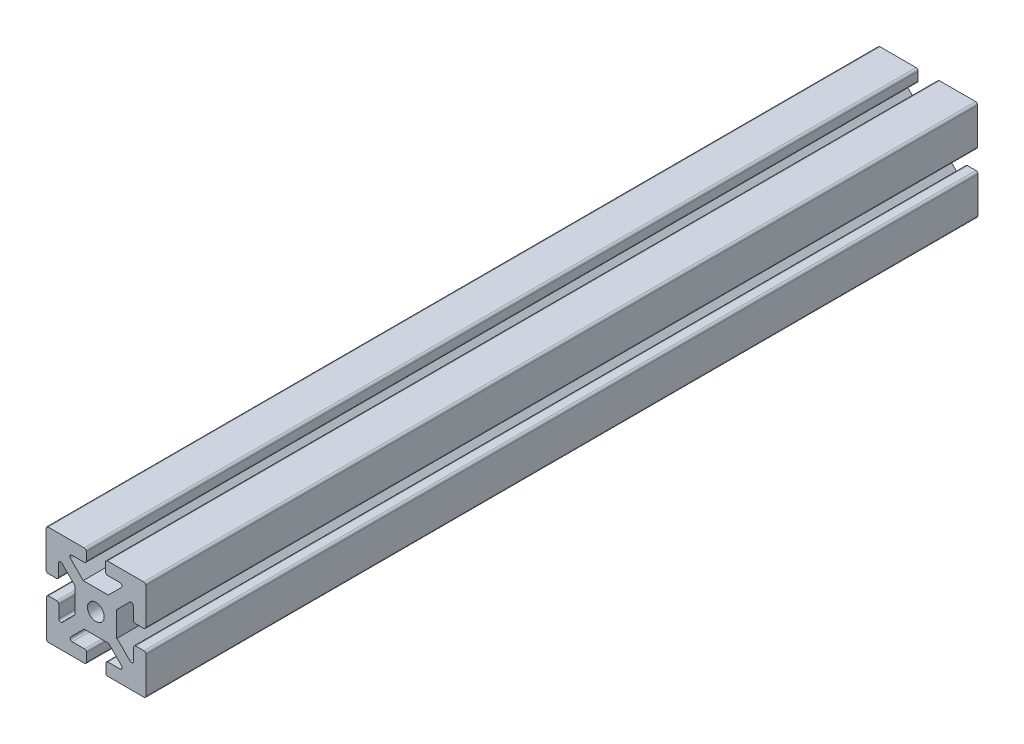
from build123d import *

# Parameters (mm, degrees)
SKETCH1_W           = 5000
SKETCH1_H           = 5000
SKETCH1_R           = 1000
BOSS_EXTRUDE1_DEPTH = 100000


with BuildPart() as part:
    # Sketch1 → Boss-Extrude1 (new body)
    # profile 1 of 5: a face of its own
    with BuildSketch(Plane.XY):
        with Locations((-570.733388509, -288.978142377)):
            Rectangle(SKETCH1_W, SKETCH1_H)
        with Locations((-570.733388509, -288.978142377)):
            Circle(SKETCH1_R, mode=Mode.SUBTRACT)
    # profile 2 of 5: a face of its own
    with BuildSketch(Plane.XY):
        with BuildLine():
            Line((5429.266611491, 1120.770586579), (5429.266611491, 5461.021857623))
            ThreePointArc((5429.266611491, 5461.021857623), (5356.043306787, 5637.79855292), (5179.266611491, 5711.021857623))
            Line((5179.266611491, 5711.021857623), (839.015340447, 5711.021857623))
            ThreePointArc((839.015340447, 5711.021857623), (662.23864515, 5637.79855292), (589.015340447, 5461.021857623))
            Line((589.015340447, 5461.021857623), (589.015340447, 4461.021857623))
            ThreePointArc((589.015340447, 4461.021857623), (662.23864515, 4284.245162327), (839.015340447, 4211.021857623))
            Line((839.015340447, 4211.021857623), (2314.345172446, 4211.021857623))
            ThreePointArc((2314.345172446, 4211.021857623), (2545.315055574, 4056.692715715), (2491.121867743, 3784.245162327))
            Line((2491.121867743, 3784.245162327), (917.89856304, 2211.021857623))
            Line((917.89856304, 2211.021857623), (1929.266611491, 1199.653809172))
            Line((1929.266611491, 1199.653809172), (3502.489916194, 2772.877113876))
            ThreePointArc((3502.489916194, 2772.877113876), (3774.937469582, 2827.070301707), (3929.266611491, 2596.100418579))
            Line((3929.266611491, 2596.100418579), (3929.266611491, 1120.770586579))
            ThreePointArc((3929.266611491, 1120.770586579), (4002.489916194, 943.993891283), (4179.266611491, 870.770586579))
            Line((4179.266611491, 870.770586579), (5179.266611491, 870.770586579))
            ThreePointArc((5179.266611491, 870.770586579), (5356.043306787, 943.993891283), (5429.266611491, 1120.770586579))
        make_face()
    # profile 3 of 5: a face of its own
    with BuildSketch(Plane.XY):
        with BuildLine():
            Line((1966.628399523, -1769.938118418), (955.260351072, -2781.306166869))
            Line((955.260351072, -2781.306166869), (2528.483655775, -4354.529471572))
            ThreePointArc((2528.483655775, -4354.529471572), (2582.676843606, -4626.97702496), (2351.706960478, -4781.306166869))
            Line((2351.706960478, -4781.306166869), (876.377128479, -4781.306166869))
            ThreePointArc((876.377128479, -4781.306166869), (699.600433182, -4854.529471572), (626.377128479, -5031.306166869))
            Line((626.377128479, -5031.306166869), (626.377128479, -6031.306166869))
            ThreePointArc((626.377128479, -6031.306166869), (699.600433182, -6208.082862166), (876.377128479, -6281.306166869))
            Line((876.377128479, -6281.306166869), (5216.628399523, -6281.306166869))
            ThreePointArc((5216.628399523, -6281.306166869), (5393.405094819, -6208.082862166), (5466.628399523, -6031.306166869))
            Line((5466.628399523, -6031.306166869), (5466.628399523, -1691.054895825))
            ThreePointArc((5466.628399523, -1691.054895825), (5393.405094819, -1514.278200528), (5216.628399523, -1441.054895825))
            Line((5216.628399523, -1441.054895825), (4216.628399523, -1441.054895825))
            ThreePointArc((4216.628399523, -1441.054895825), (4039.851704226, -1514.278200528), (3966.628399523, -1691.054895825))
            Line((3966.628399523, -1691.054895825), (3966.628399523, -3166.384727824))
            ThreePointArc((3966.628399523, -3166.384727824), (3812.299257614, -3397.354610952), (3539.851704226, -3343.161423121))
            Line((3539.851704226, -3343.161423121), (1966.628399523, -1769.938118418))
        make_face()
    # profile 4 of 5: a face of its own
    with BuildSketch(Plane.XY):
        with BuildLine():
            Line((-2014.331576518, -2818.667954901), (-3025.69962497, -1807.29990645))
            Line((-3025.69962497, -1807.29990645), (-4598.922929673, -3380.523211153))
            ThreePointArc((-4598.922929673, -3380.523211153), (-4871.370483061, -3434.716398984), (-5025.699624969, -3203.746515856))
            Line((-5025.699624969, -3203.746515856), (-5025.699624969, -1728.416683857))
            ThreePointArc((-5025.699624969, -1728.416683857), (-5098.922929673, -1551.63998856), (-5275.699624969, -1478.416683857))
            Line((-5275.699624969, -1478.416683857), (-6275.699624969, -1478.416683857))
            ThreePointArc((-6275.699624969, -1478.416683857), (-6452.476320266, -1551.63998856), (-6525.699624969, -1728.416683857))
            Line((-6525.699624969, -1728.416683857), (-6525.699624969, -6068.667954901))
            ThreePointArc((-6525.699624969, -6068.667954901), (-6452.476320266, -6245.444650198), (-6275.699624969, -6318.667954901))
            Line((-6275.699624969, -6318.667954901), (-1935.448353925, -6318.667954901))
            ThreePointArc((-1935.448353925, -6318.667954901), (-1758.671658629, -6245.444650198), (-1685.448353925, -6068.667954901))
            Line((-1685.448353925, -6068.667954901), (-1685.448353925, -5068.667954901))
            ThreePointArc((-1685.448353925, -5068.667954901), (-1758.671658629, -4891.891259604), (-1935.448353925, -4818.667954901))
            Line((-1935.448353925, -4818.667954901), (-3410.778185925, -4818.667954901))
            ThreePointArc((-3410.778185925, -4818.667954901), (-3641.748069053, -4664.338812992), (-3587.554881222, -4391.891259604))
            Line((-3587.554881222, -4391.891259604), (-2014.331576518, -2818.667954901))
        make_face()
    # profile 5 of 5: a face of its own
    with BuildSketch(Plane.XY):
        with BuildLine():
            Line((-3063.061413001, 1162.29202114), (-2051.69336455, 2173.660069591))
            Line((-2051.69336455, 2173.660069591), (-3624.916669254, 3746.883374295))
            ThreePointArc((-3624.916669254, 3746.883374295), (-3679.109857085, 4019.330927683), (-3448.139973957, 4173.660069591))
            Line((-3448.139973957, 4173.660069591), (-1972.810141957, 4173.660069591))
            ThreePointArc((-1972.810141957, 4173.660069591), (-1796.033446661, 4246.883374295), (-1722.810141957, 4423.660069591))
            Line((-1722.810141957, 4423.660069591), (-1722.810141957, 5423.660069591))
            ThreePointArc((-1722.810141957, 5423.660069591), (-1796.033446661, 5600.436764888), (-1972.810141957, 5673.660069591))
            Line((-1972.810141957, 5673.660069591), (-6313.061413002, 5673.660069591))
            ThreePointArc((-6313.061413002, 5673.660069591), (-6489.838108298, 5600.436764888), (-6563.061413002, 5423.660069591))
            Line((-6563.061413002, 5423.660069591), (-6563.061413002, 1083.408798547))
            ThreePointArc((-6563.061413002, 1083.408798547), (-6489.838108298, 906.632103251), (-6313.061413002, 833.408798547))
            Line((-6313.061413002, 833.408798547), (-5313.061413002, 833.408798547))
            ThreePointArc((-5313.061413002, 833.408798547), (-5136.284717705, 906.632103251), (-5063.061413002, 1083.408798547))
            Line((-5063.061413002, 1083.408798547), (-5063.061413002, 2558.738630547))
            ThreePointArc((-5063.061413002, 2558.738630547), (-4908.732271093, 2789.708513675), (-4636.284717705, 2735.515325844))
            Line((-4636.284717705, 2735.515325844), (-3063.061413001, 1162.29202114))
        make_face()
    extrude(amount=BOSS_EXTRUDE1_DEPTH)


solid = part.part
